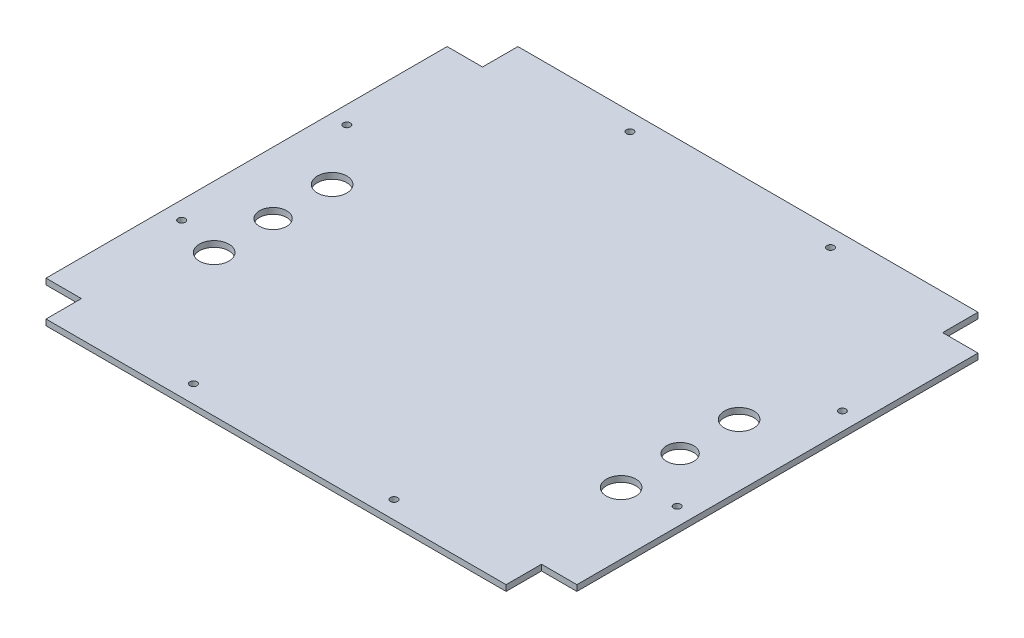
from build123d import *

# Parameters (mm, degrees)
CROQUIS1_R              = 3
CROQUIS1_R_2            = 11.5
CROQUIS1_R_3            = 12.5
SALIENTE_EXTRUIR1_DEPTH = 5


with BuildPart() as part:
    # Croquis1 → Saliente-Extruir1 (new body)
    with BuildSketch(Plane(origin=(0, 0, 0), x_dir=(1, 0, 0), z_dir=(0, 1, 0))):
        Polygon((-158.326848249, 165.982121671), (231.673151751, 165.982121671), (231.673151751, 135.982121671), (261.673151751, 135.982121671), (261.673151751, -204.017878329), (231.673151751, -204.017878329), (231.673151751, -234.017878329), (-158.326848249, -234.017878329), (-158.326848249, -204.017878329), (-188.326848249, -204.017878329), (-188.326848249, 135.982121671), (-158.326848249, 135.982121671), align=None)
        with Locations(Location((-173.326848249, 35.982121671, 0), (0, 0, 270))):
            Circle(CROQUIS1_R, mode=Mode.SUBTRACT)
        with Locations(Location((-173.326848249, -104.017878329, 0), (0, 0, 270))):
            Circle(CROQUIS1_R, mode=Mode.SUBTRACT)
        with Locations(Location((-48.326848249, 150.982121671, 0), (0, 0, 270))):
            Circle(CROQUIS1_R, mode=Mode.SUBTRACT)
        with Locations(Location((121.673151751, 150.982121671, 0), (0, 0, 270))):
            Circle(CROQUIS1_R, mode=Mode.SUBTRACT)
        with Locations(Location((246.673151751, 35.982121671, 0), (0, 0, 270))):
            Circle(CROQUIS1_R, mode=Mode.SUBTRACT)
        with Locations(Location((246.673151751, -104.017878329, 0), (0, 0, 270))):
            Circle(CROQUIS1_R, mode=Mode.SUBTRACT)
        with Locations(Location((-48.326848249, -219.017878329, 0), (0, 0, 270))):
            Circle(CROQUIS1_R, mode=Mode.SUBTRACT)
        with Locations(Location((121.673151751, -219.017878329, 0), (0, 0, 270))):
            Circle(CROQUIS1_R, mode=Mode.SUBTRACT)
        with Locations(Location((-135.826848249, -64.017878329, 0), (0, 0, 270))):
            Circle(CROQUIS1_R_2, mode=Mode.SUBTRACT)
        with Locations(Location((-135.826848249, -114.017878329, 0), (0, 0, 270))):
            Circle(CROQUIS1_R_3, mode=Mode.SUBTRACT)
        with Locations(Location((-135.826848249, -14.017878329, 0), (0, 0, 270))):
            Circle(CROQUIS1_R_3, mode=Mode.SUBTRACT)
        with Locations(Location((209.173151751, -114.017878329, 0), (0, 0, 90))):
            Circle(CROQUIS1_R_3, mode=Mode.SUBTRACT)
        with Locations(Location((209.173151751, -64.017878329, 0), (0, 0, 90))):
            Circle(CROQUIS1_R_2, mode=Mode.SUBTRACT)
        with Locations(Location((209.173151751, -14.017878329, 0), (0, 0, 90))):
            Circle(CROQUIS1_R_3, mode=Mode.SUBTRACT)
    extrude(amount=SALIENTE_EXTRUIR1_DEPTH)


solid = part.part
